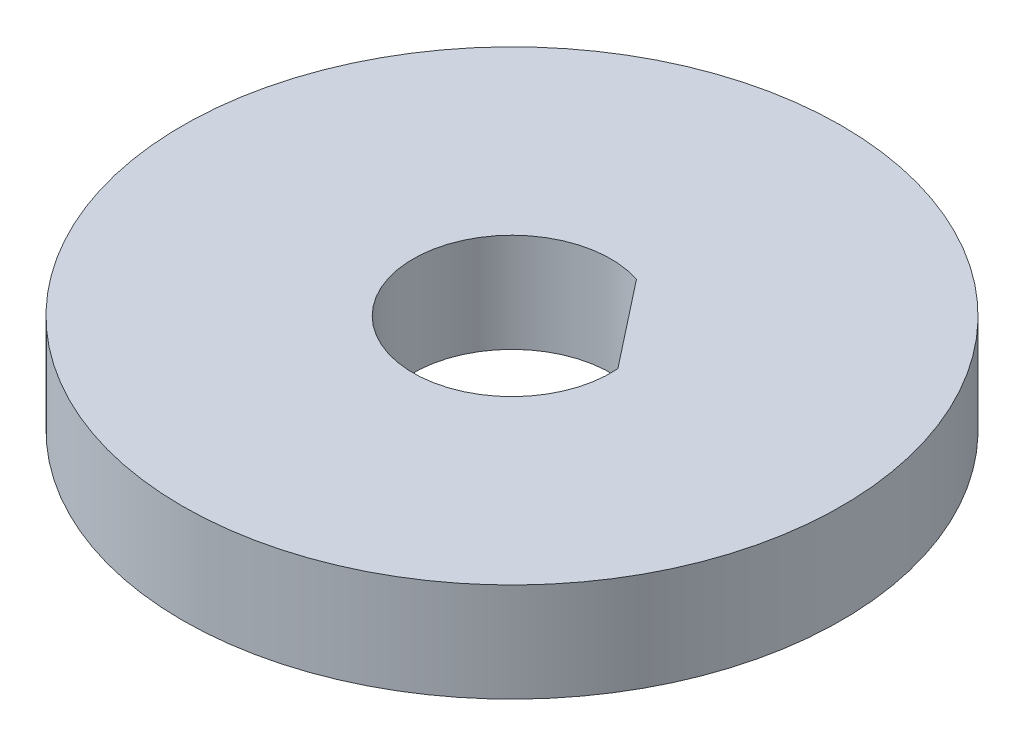
from build123d import *

# Parameters (mm, degrees)
SKETCH1_R           = 10
SKETCH1_R_2         = 3
BOSS_EXTRUDE1_DEPTH = 3
CUT_EXTRUDE1_DEPTH  = 3


with BuildPart() as part:
    # Sketch1 → Boss-Extrude1 (new body)
    # profile 1 of 2: a face of its own
    with BuildSketch(Plane(origin=(0, 0, 0), x_dir=(1, 0, 0), z_dir=(0, 1, 0))):
        with Locations(Location((0, 0, 0), (0, 0, 270))):
            Circle(SKETCH1_R)
        Circle(SKETCH1_R_2, mode=Mode.SUBTRACT)
    # profile 2 of 2: a face of its own
    with BuildSketch(Plane(origin=(0, 0, 0), x_dir=(1, 0, 0), z_dir=(0, 1, 0))):
        with BuildLine():
            ThreePointArc((1.676379413, 2.487921234), (-2.648503185, -1.409053186), (3, 0))
            ThreePointArc((3, 0), (2.648503185, 1.409053186), (1.676379413, 2.487921234))
        make_face()
    extrude(amount=BOSS_EXTRUDE1_DEPTH)

    # Sketch2 → Cut-Extrude1 (cut)
    with BuildSketch(Plane(origin=(0, 3, 0), x_dir=(1, 0, 0), z_dir=(0, 1, 0))):
        with BuildLine():
            Line((2.991913334, 0.220124066), (0.922614371, 2.85460728))
            ThreePointArc((0.922614371, 2.85460728), (-2.425679607, -1.765241752), (3, 0))
            ThreePointArc((3, 0), (2.997977652, 0.110136278), (2.991913334, 0.220124066))
        make_face()
    extrude(amount=-CUT_EXTRUDE1_DEPTH, mode=Mode.SUBTRACT)


solid = part.part
